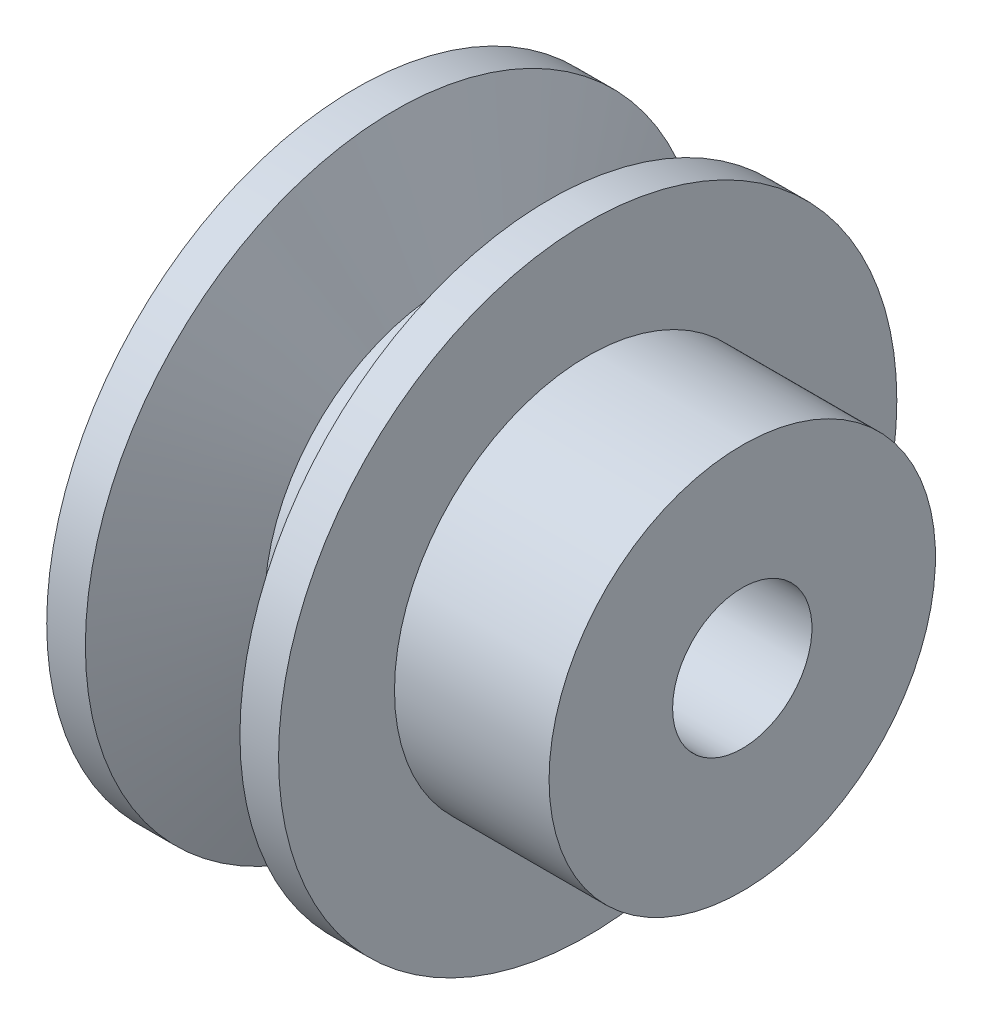
from build123d import *


with BuildPart() as part:
    # Sketch1 → Revolve1 (revolve)
    with BuildSketch(Plane.XY, mode=Mode.PRIVATE) as revolve1_sk:
        Polygon((-28.74117678, 9.014668907), (16.25882322, 9.014668907), (16.25882322, 25), (-3.74117678, 25), (-3.74117678, 40), (-8.74117678, 40), (-15.536298156, 23.595125816), (-21.946055404, 23.595125816), (-28.74117678, 40), (-33.74117678, 40), (-33.74117678, 20), align=None)
    revolve(revolve1_sk.sketch.rotate(Axis((-33.74117678, 0, 0), (1, 0, 0)), 90), axis=Axis((-33.74117678, 0, 0), (1, 0, 0)))


solid = part.part
